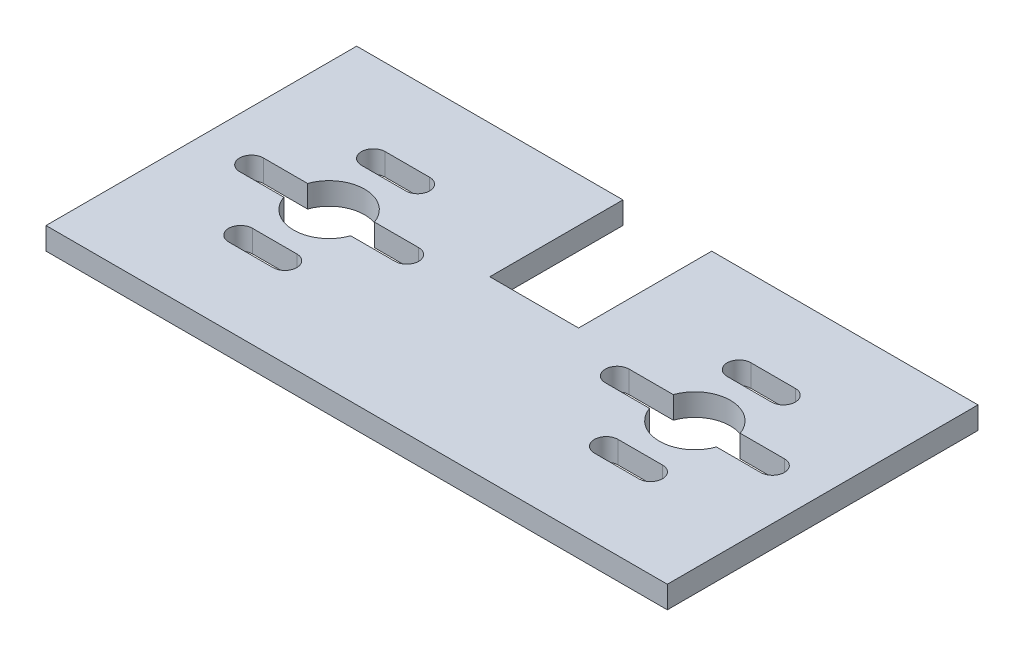
from build123d import *

# Parameters (mm, degrees)
SKETCH1_W           = 88.9
SKETCH1_H           = 44.45
BOSS_EXTRUDE1_DEPTH = 3.175
CUT_EXTRUDE1_DEPTH  = 50.797929174
SKETCH7_W           = 12.7
SKETCH7_H           = 19.05
CUT_EXTRUDE2_DEPTH  = 50.797929174


with BuildPart() as part:
    # Sketch1 → Boss-Extrude1 (new body)
    with BuildSketch(Plane(origin=(0, 0, 0), x_dir=(1, 0, 0), z_dir=(0, 1, 0))):
        Rectangle(SKETCH1_W, SKETCH1_H)
    extrude(amount=BOSS_EXTRUDE1_DEPTH)

    # Sketch3 → Cut-Extrude1 (cut, through all)
    with BuildSketch(Plane.XZ):
        with BuildLine():
            Line((-22.9888034, 11.2), (-29.3388034, 11.2))
            ThreePointArc((-29.3388034, 11.2), (-31.0388034, 9.5), (-29.3388034, 7.8))
            Line((-29.3388034, 7.8), (-22.9888034, 7.8))
            ThreePointArc((-22.9888034, 7.8), (-21.2888034, 9.5), (-22.9888034, 11.2))
        make_face()
        with BuildLine():
            Line((-30.950911086, 1.7), (-37.2763034, 1.7))
            ThreePointArc((-37.2763034, 1.7), (-38.9763034, 0), (-37.2763034, -1.7))
            Line((-37.2763034, -1.7), (-30.950911086, -1.7))
            ThreePointArc((-30.950911086, -1.7), (-31.2438034, 0), (-30.950911086, 1.7))
        make_face()
        with BuildLine():
            Line((-21.376695714, 1.7), (-30.950911086, 1.7))
            ThreePointArc((-30.950911086, 1.7), (-31.2438034, 0), (-30.950911086, -1.7))
            Line((-30.950911086, -1.7), (-21.376695714, -1.7))
            ThreePointArc((-21.376695714, -1.7), (-21.157561943, -0.86252332), (-21.0838034, 0))
            ThreePointArc((-21.0838034, 0), (-21.157561943, 0.86252332), (-21.376695714, 1.7))
        make_face()
        with BuildLine():
            ThreePointArc((-21.376695714, 1.7), (-26.1638034, 5.08), (-30.950911086, 1.7))
            Line((-30.950911086, 1.7), (-21.376695714, 1.7))
        make_face()
        with BuildLine():
            Line((-15.0513034, 1.7), (-21.376695714, 1.7))
            ThreePointArc((-21.376695714, 1.7), (-21.157561943, 0.86252332), (-21.0838034, 0))
            ThreePointArc((-21.0838034, 0), (-21.157561943, -0.86252332), (-21.376695714, -1.7))
            Line((-21.376695714, -1.7), (-15.0513034, -1.7))
            ThreePointArc((-15.0513034, -1.7), (-13.3513034, 0), (-15.0513034, 1.7))
        make_face()
        with BuildLine():
            Line((-21.376695714, -1.7), (-30.950911086, -1.7))
            ThreePointArc((-30.950911086, -1.7), (-26.1638034, -5.08), (-21.376695714, -1.7))
        make_face()
        with BuildLine():
            Line((-29.3388034, -11.2), (-22.9888034, -11.2))
            ThreePointArc((-22.9888034, -11.2), (-21.2888034, -9.5), (-22.9888034, -7.8))
            Line((-22.9888034, -7.8), (-29.3388034, -7.8))
            ThreePointArc((-29.3388034, -7.8), (-31.0388034, -9.5), (-29.3388034, -11.2))
        make_face()
    cut_extrude1 = extrude(amount=-CUT_EXTRUDE1_DEPTH, mode=Mode.SUBTRACT)

    # Mirror1: Cut-Extrude1 across plane
    add(cut_extrude1.mirror(Plane(origin=(0, 0, 0), x_dir=(0, 0, 1), z_dir=(1, 0, 0))), mode=Mode.SUBTRACT)

    # Sketch7 → Cut-Extrude2 (cut, through all)
    with BuildSketch(Plane(origin=(0, 3.175, 0), x_dir=(1, 0, 0), z_dir=(0, 1, 0))):
        with Locations((0, 12.7)):
            Rectangle(SKETCH7_W, SKETCH7_H)
    extrude(amount=-CUT_EXTRUDE2_DEPTH, mode=Mode.SUBTRACT)


solid = part.part
